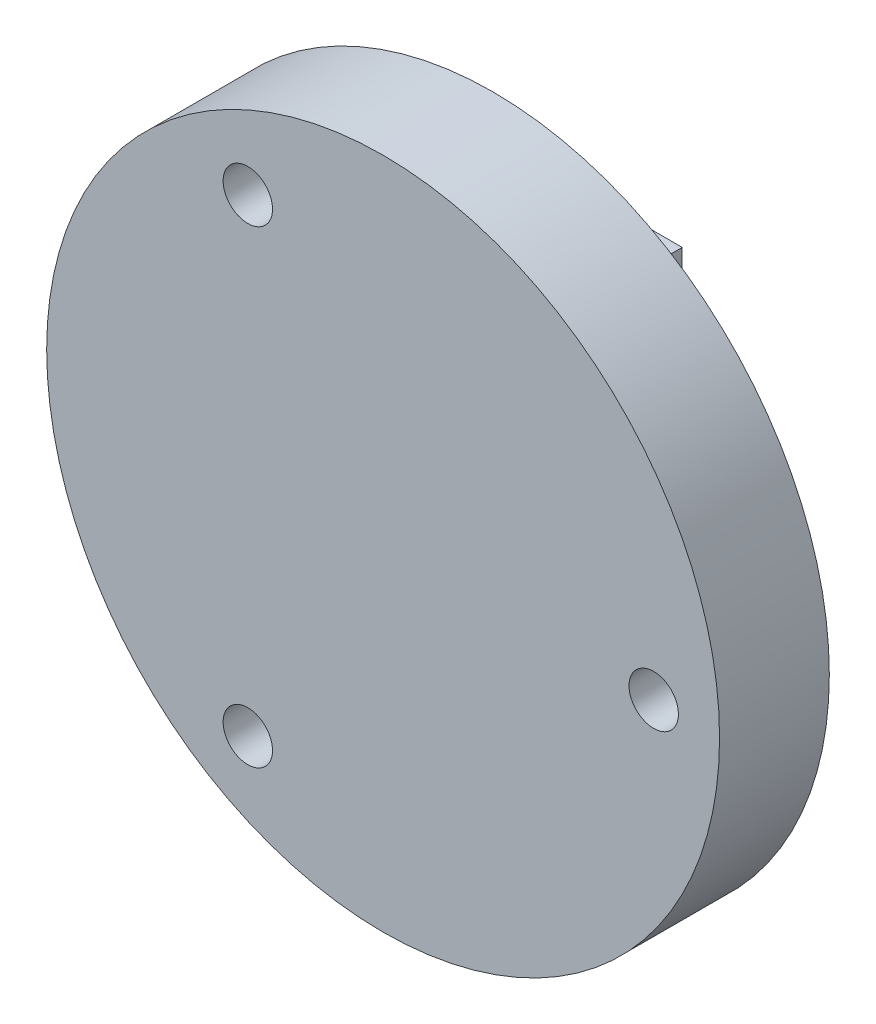
from build123d import *

# Parameters (mm, degrees)
SKETCH_288_R           = 30.65
SKETCH_288_R_2         = 2.25
EXTRUDE_1509_DEPTH     = 10
SKETCH_1_3_R           = 3.55
SKETCH_1_3_R_2         = 2.25
CUT_EXTRUDE_1553_DEPTH = 5
SKETCH_1_5_W           = 10.5
SKETCH_1_5_H           = 30
EXTRUDE_2_DEPTH        = 12
CUT_EXTRUDE_2473_REACH = 50.706
SKETCH_2180_R          = 2.15


with BuildPart() as part:
    # Sketch 288 → Extrude 1509 (new body)
    with BuildSketch(Plane.XY):
        Circle(SKETCH_288_R)
        with Locations((24.65, 0)):
            Circle(SKETCH_288_R_2, mode=Mode.SUBTRACT)
        with Locations((-12.325, -21.347526203)):
            Circle(SKETCH_288_R_2, mode=Mode.SUBTRACT)
        with Locations((-12.325, 21.347526203)):
            Circle(SKETCH_288_R_2, mode=Mode.SUBTRACT)
    extrude(amount=EXTRUDE_1509_DEPTH)

    # Эскиз1<3> → Cut-Extrude 1553 (cut)
    # profile 1 of 3: a face of its own
    with BuildSketch(Plane.XY):
        with Locations((24.65, 0)):
            Circle(SKETCH_1_3_R)
        with Locations((24.65, 0)):
            Circle(SKETCH_1_3_R_2, mode=Mode.SUBTRACT)
    # profile 2 of 3: a face of its own
    with BuildSketch(Plane.XY):
        with Locations((-12.325, 21.347526203)):
            Circle(SKETCH_1_3_R)
        with Locations((-12.325, 21.347526203)):
            Circle(SKETCH_1_3_R_2, mode=Mode.SUBTRACT)
    # profile 3 of 3: a face of its own
    with BuildSketch(Plane.XY):
        with Locations((-12.325, -21.347526203)):
            Circle(SKETCH_1_3_R)
        with Locations((-12.325, -21.347526203)):
            Circle(SKETCH_1_3_R_2, mode=Mode.SUBTRACT)
    extrude(amount=CUT_EXTRUDE_1553_DEPTH, mode=Mode.SUBTRACT)

    # Эскиз1<5> → Бобышка-Вытянуть2 (add)
    with BuildSketch(Plane.XY):
        Rectangle(SKETCH_1_5_W, SKETCH_1_5_H)
    extrude(amount=-EXTRUDE_2_DEPTH)

    # Sketch 2180 → Cut-Extrude 2473 (cut, up to next)
    with BuildSketch(Plane.ZY.offset(5.25), mode=Mode.PRIVATE) as cut_extrude_2473_sk1:
        with Locations((-5, 7.5)):
            Circle(SKETCH_2180_R)
    cut_extrude_2473_tool1 = extrude(cut_extrude_2473_sk1.sketch, amount=-CUT_EXTRUDE_2473_REACH, mode=Mode.PRIVATE) & part.part
    # Sketch 2180 → Cut-Extrude 2473 (cut, up to next)
    with BuildSketch(Plane.ZY.offset(5.25), mode=Mode.PRIVATE) as cut_extrude_2473_sk2:
        with Locations((-5, -7.5)):
            Circle(SKETCH_2180_R)
    cut_extrude_2473_tool2 = extrude(cut_extrude_2473_sk2.sketch, amount=-CUT_EXTRUDE_2473_REACH, mode=Mode.PRIVATE) & part.part
    add(cut_extrude_2473_tool1.solids().sort_by_distance((-5.25, 7.5, -5))[0], mode=Mode.SUBTRACT)
    add(cut_extrude_2473_tool2.solids().sort_by_distance((-5.25, -7.5, -5))[0], mode=Mode.SUBTRACT)


solid = part.part
